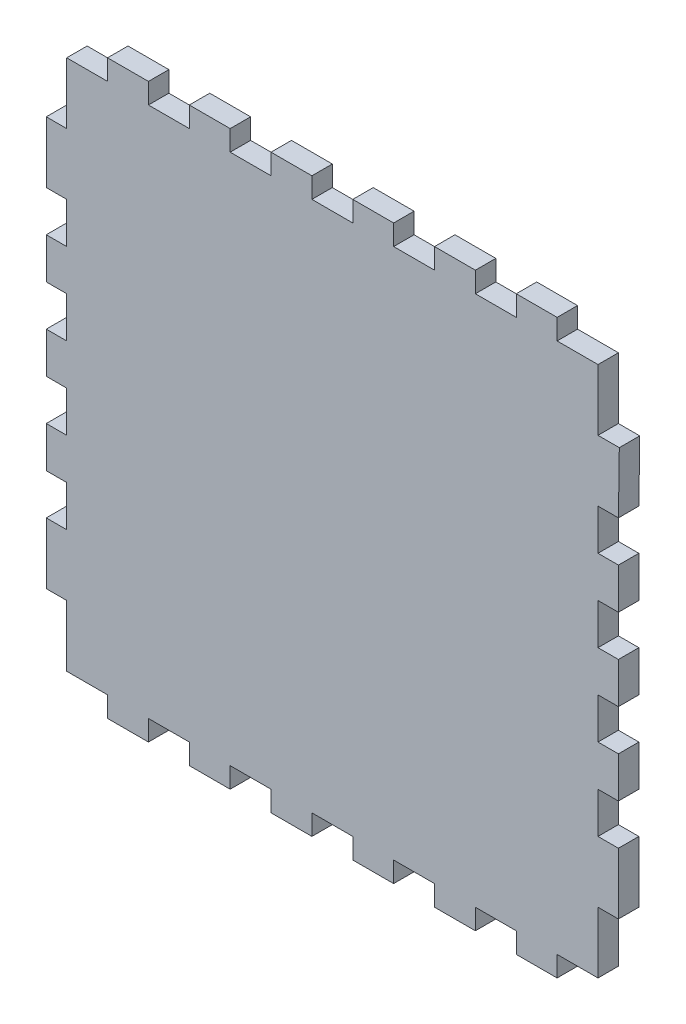
from build123d import *

# Parameters (mm, degrees)
BOSS_EXTRUDE2_DEPTH = 5


with BuildPart() as part:
    # Sketch1 → Boss-Extrude2 (new body)
    with BuildSketch(Plane.XY):
        Polygon((-44.808964075, -69.870541313), (-34.808964075, -69.870541313), (-34.808964075, -74.870541313), (-24.808964075, -74.870541313), (-24.808964075, -69.870541313), (-14.808964075, -69.870541313), (-14.808964075, -74.870541313), (-4.808964075, -74.870541313), (-4.808964075, -69.870541313), (5.191035925, -69.870541313), (5.191035925, -74.870541313), (15.191035925, -74.870541313), (15.191035925, -69.870541313), (25.191035925, -69.870541313), (25.191035925, -74.870541313), (35.191035925, -74.870541313), (35.191035925, -69.870541313), (45.191035925, -69.870541313), (45.191035925, -74.870541313), (55.191035925, -74.870541313), (55.191035925, -69.870541313), (65.191035925, -69.870541313), (65.191035925, -54.870541313), (70.191035925, -54.870541313), (70.191035925, -39.870541313), (65.191035925, -39.870541313), (65.191035925, -29.870541313), (70.191035925, -29.870541313), (70.191035925, -19.870541313), (65.191035925, -19.870541313), (65.191035925, -9.870541313), (70.191035925, -9.870541313), (70.191035925, 0.129458687), (65.191035925, 0.129458687), (65.191035925, 10.129458687), (70.191035925, 10.129458687), (70.191035925, 20.129458687), (65.191035925, 20.129458687), (65.191035925, 30.129458687), (70.191035925, 30.129458687), (70.407152599, 45.123402037), (65.191035925, 45.123402037), (65.191035925, 60.123402037), (55.191035925, 60.123402037), (55.191035925, 65.123402037), (45.191035925, 65.123402037), (45.191035925, 60.123402037), (35.191035925, 60.123402037), (35.191035925, 65.123402037), (25.191035925, 65.123402037), (25.191035925, 60.123402037), (15.191035925, 60.123402037), (15.191035925, 65.123402037), (5.191035925, 65.123402037), (5.191035925, 60.123402037), (-4.808964075, 60.123402037), (-4.808964075, 65.123402037), (-14.808964075, 65.123402037), (-14.808964075, 60.123402037), (-24.808964075, 60.123402037), (-24.808964075, 65.123402037), (-34.808964075, 65.123402037), (-34.808964075, 60.123402037), (-44.808964075, 60.123402037), (-44.808964075, 65.123402037), (-54.808964075, 65.123402037), (-54.808964075, 60.123402037), (-64.808964075, 60.123402037), (-64.808964075, 45.123402037), (-69.808964075, 45.123402037), (-69.808964075, 30.123402037), (-64.808964075, 30.129458687), (-64.808964075, 20.129458687), (-69.808964075, 20.129458687), (-69.808964075, 10.129458687), (-64.808964075, 10.129458687), (-64.808964075, 0.129458687), (-69.808964075, 0.129458687), (-69.808964075, -9.870541313), (-64.808964075, -9.870541313), (-64.808964075, -19.870541313), (-69.808964075, -19.870541313), (-69.808964075, -29.870541313), (-64.808964075, -29.870541313), (-64.808964075, -39.870541313), (-69.808964075, -39.870541313), (-69.808964075, -54.870541313), (-64.808964075, -54.870541313), (-64.808964075, -69.870541313), (-54.808964075, -69.870541313), (-54.808964075, -74.870541313), (-44.808964075, -74.870541313), align=None)
    extrude(amount=BOSS_EXTRUDE2_DEPTH)


solid = part.part
